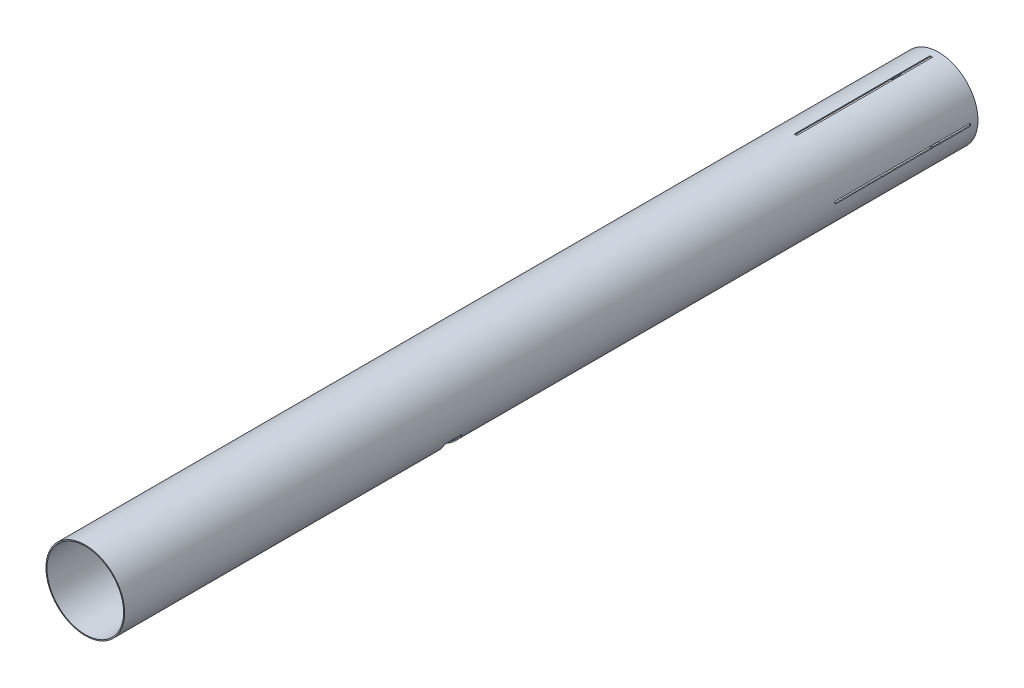
from build123d import *

# Parameters (mm, degrees)
SKETCH1_R               = 78.35
SKETCH1_R_2             = 76.35
BOSS_EXTRUDE1_DEPTH     = 1700
SKETCH5_R               = 15
CUT_EXTRUDE2_DEPTH      = 1704.607186237
SKETCH6_W               = 4.8
SKETCH6_H               = 270
CUT_EXTRUDE3_DEPTH      = 1704.607186346
CIRPATTERN1_COUNT       = 2
CIRPATTERN1_ANGLE       = 90
CUT_EXTRUDE4_DEPTH      = 17.5
CUT_EXTRUDE4_DEPTH_BACK = 17.5


with BuildPart() as part:
    # Sketch1 → Boss-Extrude1 (new body)
    with BuildSketch(Plane.XY):
        Circle(SKETCH1_R)
        Circle(SKETCH1_R_2, mode=Mode.SUBTRACT)
    extrude(amount=BOSS_EXTRUDE1_DEPTH)

    # Sketch5 → Cut-Extrude2 (cut, through all)
    with BuildSketch(Plane(origin=(0, 0, 0), x_dir=(0, 0, -1), z_dir=(0.7071067811865489, -0.7071067811865462, 0))):
        with Locations(Location((-1034.89, 0, 0), (0, 0, 270))):
            Circle(SKETCH5_R)
    extrude(amount=CUT_EXTRUDE2_DEPTH, mode=Mode.SUBTRACT)

    # Sketch6 → Cut-Extrude3 (cut, symmetric)
    with BuildSketch(Plane(origin=(0, 0, 0), x_dir=(1, 0, 0), z_dir=(0, 1, 0))):
        with Locations((0, -150)):
            Rectangle(SKETCH6_W, SKETCH6_H)
    cut_extrude3 = extrude(amount=CUT_EXTRUDE3_DEPTH, both=True, mode=Mode.SUBTRACT)

    # CirPattern1: Cut-Extrude3 ×2 about axis
    cirpattern1_axis = Axis((0, 0, 0), (0, 0, 1))
    for i in range(1, CIRPATTERN1_COUNT):
        add(cut_extrude3.rotate(cirpattern1_axis, i * CIRPATTERN1_ANGLE / (CIRPATTERN1_COUNT - 1)), mode=Mode.SUBTRACT)

    # Sketch7 → Cut-Extrude4 (cut, two sides: drawn at the far end of the back side and taken through both)
    with BuildSketch(Plane.XY.offset(1035).offset(-CUT_EXTRUDE4_DEPTH_BACK)):
        with BuildLine():
            Line((65.460051126, -39.297636146), (67.174787239, -40.327043772))
            ThreePointArc((67.174787239, -40.327043772), (67.934531185, -39.03360056), (68.669373093, -37.725849215))
            Line((68.669373093, -37.725849215), (66.916485458, -36.762840939))
            ThreePointArc((66.916485458, -36.762840939), (66.20040148, -38.03720999), (65.460051126, -39.297636146))
        make_face()
        with BuildLine():
            Line((37, -66.785645913), (37.969220694, -68.535106186))
            ThreePointArc((37.969220694, -68.535106186), (39.274356912, -67.795629573), (40.565096747, -67.031301837))
            Line((40.565096747, -67.031301837), (39.529612465, -65.320228401))
            ThreePointArc((39.529612465, -65.320228401), (38.271820679, -66.065045538), (37, -66.785645913))
        make_face()
        with BuildLine():
            Line((39.529612465, -65.320228401), (40.565096747, -67.031301837))
            ThreePointArc((40.565096747, -67.031301837), (48.389164921, -61.621515871), (55.5, -55.303458301))
            Line((55.5, -55.303458301), (54.083280153, -53.891755472))
            ThreePointArc((54.083280153, -53.891755472), (47.15395969, -60.048535249), (39.529612465, -65.320228401))
        make_face()
        with BuildLine():
            Line((54.083280153, -53.891755472), (55.5, -55.303458301))
            ThreePointArc((55.5, -55.303458301), (61.792791684, -48.170254265), (67.174787239, -40.327043772))
            Line((67.174787239, -40.327043772), (65.460051126, -39.297636146))
            ThreePointArc((65.460051126, -39.297636146), (60.215438992, -46.940637053), (54.083280153, -53.891755472))
        make_face()
    extrude(amount=CUT_EXTRUDE4_DEPTH + CUT_EXTRUDE4_DEPTH_BACK, mode=Mode.SUBTRACT)


solid = part.part
